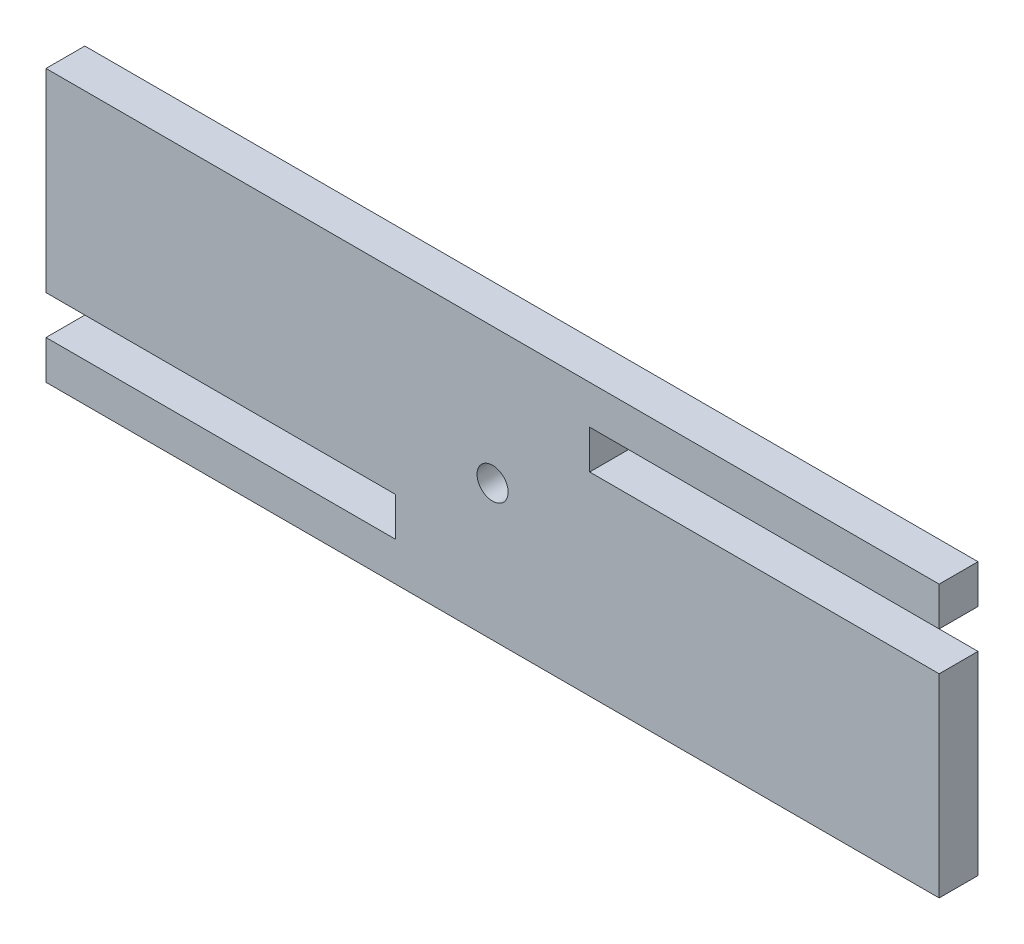
from build123d import *

# Parameters (mm, degrees)
SKETCH1_R           = 4
BOSS_EXTRUDE2_DEPTH = 10


with BuildPart() as part:
    # Sketch1 → Boss-Extrude2 (new body)
    with BuildSketch(Plane.XY):
        Polygon((-115, 35), (115, 35), (115, 25), (25, 25), (25, 15), (115, 15), (115, -35), (-115, -35), (-115, -25), (-25, -25), (-25, -15), (-115, -15), align=None)
        Circle(SKETCH1_R, mode=Mode.SUBTRACT)
    extrude(amount=BOSS_EXTRUDE2_DEPTH)


solid = part.part
